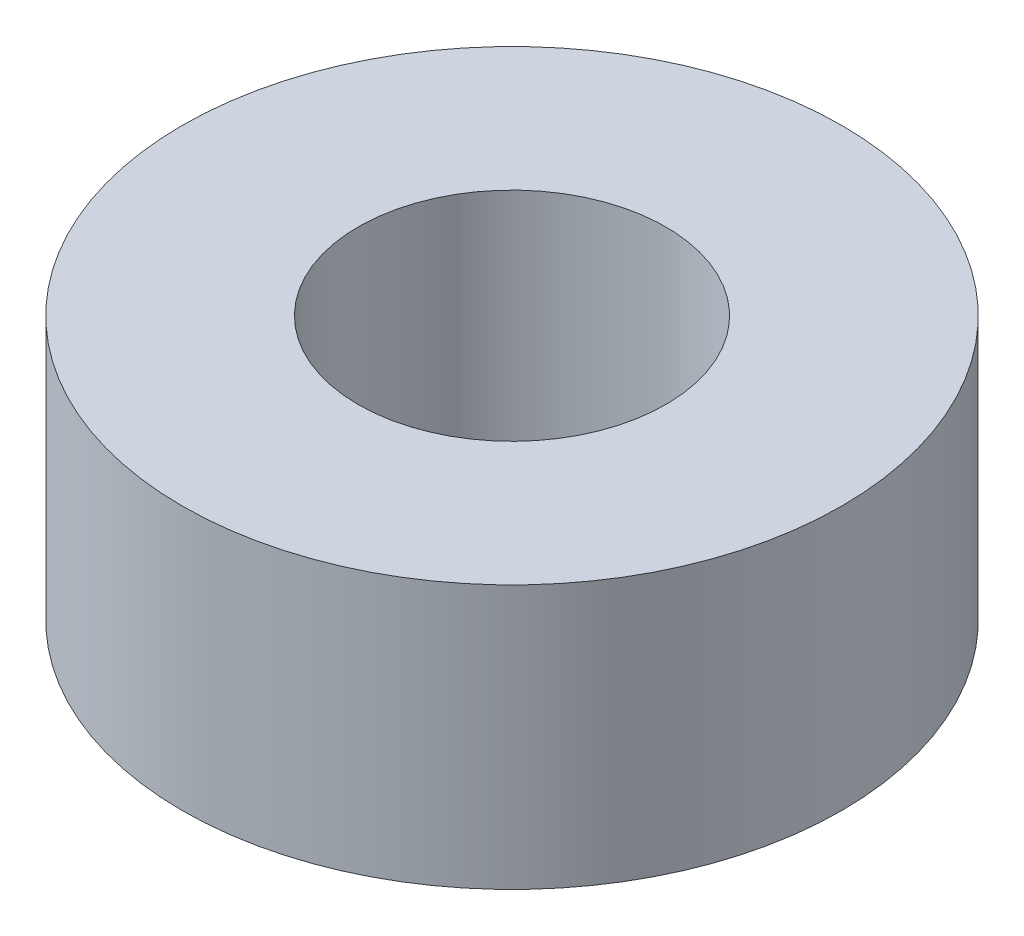
from build123d import *

# Parameters (mm, degrees)
SKETCH1_R           = 3.75
SKETCH1_R_2         = 1.75
BOSS_EXTRUDE1_DEPTH = 3


with BuildPart() as part:
    # Sketch1 → Boss-Extrude1 (new body)
    with BuildSketch(Plane(origin=(0, 0, 0), x_dir=(1, 0, 0), z_dir=(0, 1, 0))):
        with Locations(Location((0, 0, 0), (0, 0, 270))):
            Circle(SKETCH1_R)
        with Locations(Location((0, 0, 0), (0, 0, 270))):
            Circle(SKETCH1_R_2, mode=Mode.SUBTRACT)
    extrude(amount=BOSS_EXTRUDE1_DEPTH)


solid = part.part
